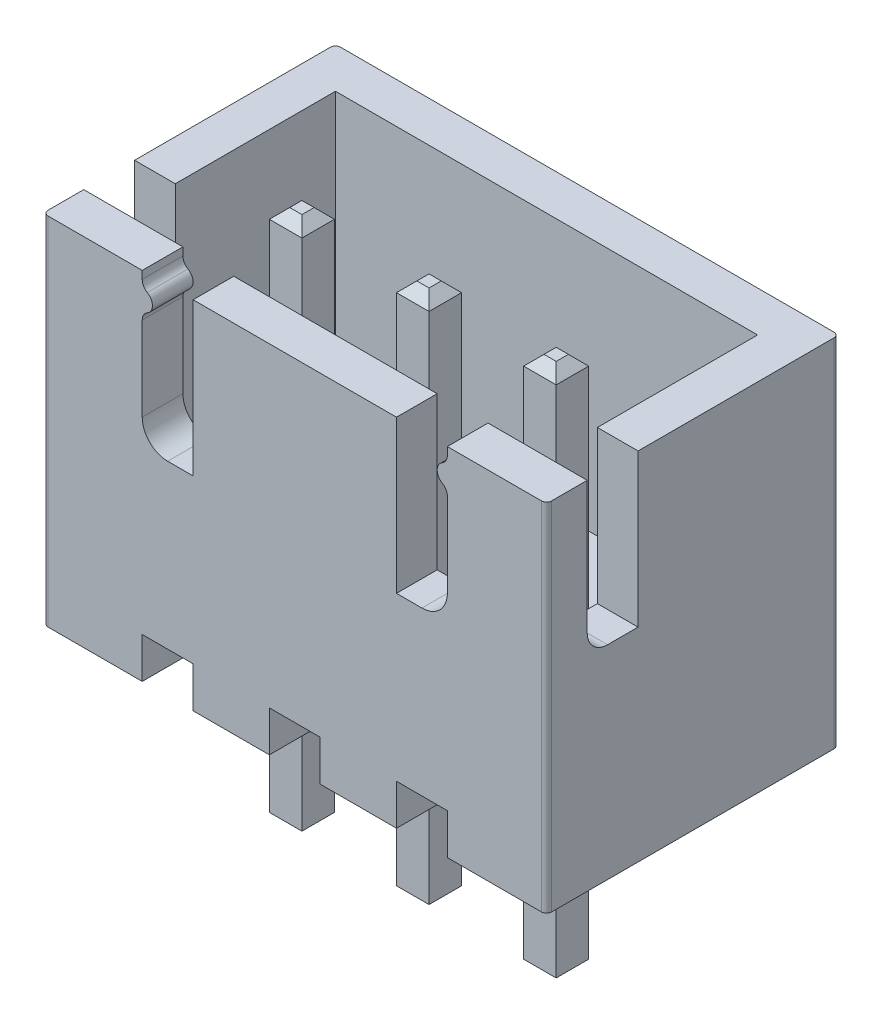
from build123d import *

# Parameters (mm, degrees)
SKETCH_1_W                         = 9.9
SKETCH_1_H                         = 5.75
EXTRUDE_1_DEPTH                    = 7
SKETCH_2_W                         = 8.3
SKETCH_2_H                         = 4.15
CUT_EXTRUDE_1_DEPTH                = 5
CUT_EXTRUDE_2_REACH                = 15.419
SKETCH_3_W                         = 1
SKETCH_3_H                         = 0.8
EXTRUDE_START                      = -5.5
SKETCH_4_W                         = 0.64
SKETCH_4_H                         = 0.64
EXTRUDE_2_DEPTH                    = 10.5
CHAMFER_1_SIZE                     = 0.2
PATTERN_LINEAR_4_COUNT             = 3
PATTERN_LINEAR_4_PITCH             = 2.5
CHAMFER_1_OF_PATTERN_LINEAR_4_SIZE = 0.2
CUT_EXTRUDE_3_REACH                = 15.419
CUT_EXTRUDE_4_DEPTH                = 14.419109508
FILLET_1_R                         = 0.1


with BuildPart() as part:
    # Эскиз1 → Бобышка-Вытянуть1 (new body)
    with BuildSketch(Plane(origin=(0, 0, 0), x_dir=(1, 0, 0), z_dir=(0, 1, 0))):
        with Locations((4.95, 2.875)):
            Rectangle(SKETCH_1_W, SKETCH_1_H)
    extrude(amount=EXTRUDE_1_DEPTH)

    # Эскиз2 → Вырез-Вытянуть1 (cut)
    with BuildSketch(Plane(origin=(0, 7, 0), x_dir=(1, 0, 0), z_dir=(0, 1, 0))):
        with Locations((4.95, 2.875)):
            Rectangle(SKETCH_2_W, SKETCH_2_H)
    extrude(amount=-CUT_EXTRUDE_1_DEPTH, mode=Mode.SUBTRACT)

    # Эскиз3 → Вырез-Вытянуть2 (cut, up to next)
    with BuildSketch(Plane.XY, mode=Mode.PRIVATE) as cut_extrude_2_sk1:
        with Locations((2.45, 0.4)):
            Rectangle(SKETCH_3_W, SKETCH_3_H)
    cut_extrude_2_tool1 = extrude(cut_extrude_2_sk1.sketch, amount=-CUT_EXTRUDE_2_REACH, mode=Mode.PRIVATE) & part.part
    # Эскиз3 → Вырез-Вытянуть2 (cut, up to next)
    with BuildSketch(Plane.XY, mode=Mode.PRIVATE) as cut_extrude_2_sk2:
        with Locations((4.95, 0.4)):
            Rectangle(SKETCH_3_W, SKETCH_3_H)
    cut_extrude_2_tool2 = extrude(cut_extrude_2_sk2.sketch, amount=-CUT_EXTRUDE_2_REACH, mode=Mode.PRIVATE) & part.part
    # Эскиз3 → Вырез-Вытянуть2 (cut, up to next)
    with BuildSketch(Plane.XY, mode=Mode.PRIVATE) as cut_extrude_2_sk3:
        with Locations((7.45, 0.4)):
            Rectangle(SKETCH_3_W, SKETCH_3_H)
    cut_extrude_2_tool3 = extrude(cut_extrude_2_sk3.sketch, amount=-CUT_EXTRUDE_2_REACH, mode=Mode.PRIVATE) & part.part
    add(cut_extrude_2_tool1.solids().sort_by_distance((2.45, 0.4, 0))[0], mode=Mode.SUBTRACT)
    add(cut_extrude_2_tool2.solids().sort_by_distance((4.95, 0.4, 0))[0], mode=Mode.SUBTRACT)
    add(cut_extrude_2_tool3.solids().sort_by_distance((7.45, 0.4, 0))[0], mode=Mode.SUBTRACT)

    # Эскиз4 → Бобышка-Вытянуть2 (add)
    with BuildSketch(Plane(origin=(0, 2, 0), x_dir=(1, 0, 0), z_dir=(0, 1, 0)).offset(EXTRUDE_START)):
        with Locations((2.45, 2.64)):
            Rectangle(SKETCH_4_W, SKETCH_4_H)
    extrude_2 = extrude(amount=EXTRUDE_2_DEPTH)

    # Фаска1
    chamfer_1_edges = [part.edges().sort_by_distance(p)[0] for p in [
        (2.13, 7, -2.64),
        (2.13, -3.5, -2.64),
        (2.45, 7, -2.96),
        (2.45, -3.5, -2.96),
        (2.77, 7, -2.64),
        (2.77, -3.5, -2.64),
        (2.45, 7, -2.32),
        (2.45, -3.5, -2.32),
    ]]
    chamfer(chamfer_1_edges, length=CHAMFER_1_SIZE)

    # Линейный массив4: Бобышка-Вытянуть2 ×3
    with Locations(*[(i * PATTERN_LINEAR_4_PITCH, 0, 0) for i in range(1, PATTERN_LINEAR_4_COUNT)]):
        add(extrude_2)

    # Фаска1 of Линейный массив4
    chamfer_1_of_pattern_linear_4_edges = [part.edges().sort_by_distance(p)[0] for p in [
        (4.63, 7, -2.64),
        (4.63, -3.5, -2.64),
        (4.95, 7, -2.96),
        (4.95, -3.5, -2.96),
        (5.27, 7, -2.64),
        (5.27, -3.5, -2.64),
        (4.95, 7, -2.32),
        (4.95, -3.5, -2.32),
        (7.13, 7, -2.64),
        (7.13, -3.5, -2.64),
        (7.45, 7, -2.96),
        (7.45, -3.5, -2.96),
        (7.77, 7, -2.64),
        (7.77, -3.5, -2.64),
        (7.45, 7, -2.32),
        (7.45, -3.5, -2.32),
    ]]
    chamfer(chamfer_1_of_pattern_linear_4_edges, length=CHAMFER_1_OF_PATTERN_LINEAR_4_SIZE)

    # Эскиз5 → Вырез-Вытянуть3 (cut, up to next)
    with BuildSketch(Plane.XY, mode=Mode.PRIVATE) as cut_extrude_3_sk1:
        with BuildLine():
            Line((1.95, 7), (2.95, 7))
            Line((2.95, 7), (2.95, 4))
            Line((2.95, 4), (2.45, 4))
            ThreePointArc((2.45, 4), (2.096446609, 4.146446609), (1.95, 4.5))
            Line((1.95, 4.5), (1.95, 6.153589838))
            ThreePointArc((1.95, 6.153589838), (1.976794919, 6.253589838), (2.05, 6.326794919))
            ThreePointArc((2.05, 6.326794919), (2.15, 6.5), (2.05, 6.673205081))
            ThreePointArc((2.05, 6.673205081), (1.976794919, 6.746410162), (1.95, 6.846410162))
            Line((1.95, 6.846410162), (1.95, 7))
        make_face()
    cut_extrude_3_tool1 = extrude(cut_extrude_3_sk1.sketch, amount=-CUT_EXTRUDE_3_REACH, mode=Mode.PRIVATE) & part.part
    # Эскиз5 → Вырез-Вытянуть3 (cut, up to next)
    with BuildSketch(Plane.XY, mode=Mode.PRIVATE) as cut_extrude_3_sk2:
        with BuildLine():
            Line((6.95, 7), (7.95, 7))
            Line((7.95, 7), (7.95, 6.846410162))
            ThreePointArc((7.95, 6.846410162), (7.923205081, 6.746410162), (7.85, 6.673205081))
            ThreePointArc((7.85, 6.673205081), (7.75, 6.5), (7.85, 6.326794919))
            ThreePointArc((7.85, 6.326794919), (7.923205081, 6.253589838), (7.95, 6.153589838))
            Line((7.95, 6.153589838), (7.95, 4.5))
            ThreePointArc((7.95, 4.5), (7.803553391, 4.146446609), (7.45, 4))
            Line((7.45, 4), (6.95, 4))
            Line((6.95, 4), (6.95, 7))
        make_face()
    cut_extrude_3_tool2 = extrude(cut_extrude_3_sk2.sketch, amount=-CUT_EXTRUDE_3_REACH, mode=Mode.PRIVATE) & part.part
    add(cut_extrude_3_tool1.solids().sort_by_distance((2.467377, 5.501808, 0))[0], mode=Mode.SUBTRACT)
    add(cut_extrude_3_tool2.solids().sort_by_distance((7.432623, 5.501808, 0))[0], mode=Mode.SUBTRACT)

    # Эскиз6 → Вырез-Вытянуть4 (cut, through all)
    with BuildSketch(Plane(origin=(9.9, 0, 0), x_dir=(0, 0, -1), z_dir=(1, 0, 0))):
        with BuildLine():
            Line((0.8, 7), (1.8, 7))
            Line((1.8, 7), (1.8, 4))
            Line((1.8, 4), (1.2, 4))
            ThreePointArc((1.2, 4), (0.917157288, 4.117157288), (0.8, 4.4))
            Line((0.8, 4.4), (0.8, 7))
        make_face()
    extrude(amount=-CUT_EXTRUDE_4_DEPTH, mode=Mode.SUBTRACT)

    # Скругление1
    fillet_1_edges = [part.edges().sort_by_distance(p)[0] for p in [
        (0, 3.5, -5.75),
        (9.9, 3.5, -5.75),
        (9.9, 3.5, 0),
        (0, 3.5, 0),
    ]]
    fillet(fillet_1_edges, radius=FILLET_1_R)


solid = part.part
